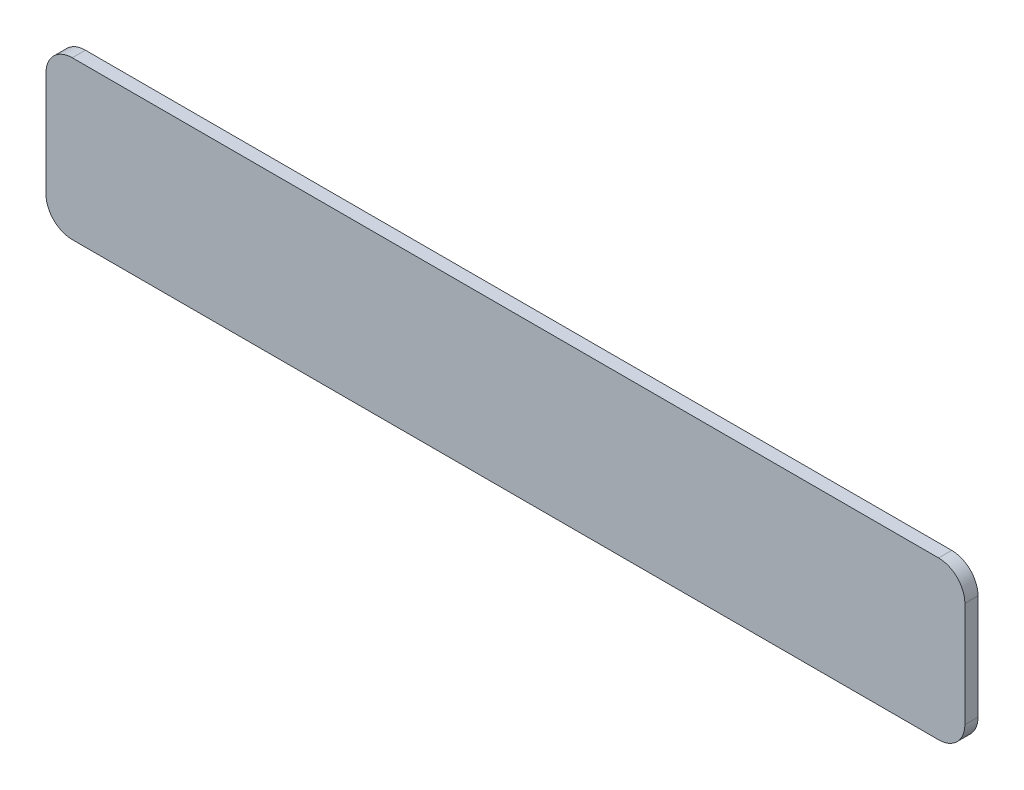
from build123d import *

# Parameters (mm, degrees)
BOSS_EXTRUDE1_DEPTH = 1


with BuildPart() as part:
    # Sketch1 → Boss-Extrude1 (new body)
    with BuildSketch(Plane.XY):
        with BuildLine():
            Line((-33, -6), (33, -6))
            ThreePointArc((33, -6), (34.414213562, -5.414213562), (35, -4))
            Line((35, -4), (35, 4))
            ThreePointArc((35, 4), (34.414213562, 5.414213562), (33, 6))
            Line((33, 6), (-33, 6))
            ThreePointArc((-33, 6), (-34.414213562, 5.414213562), (-35, 4))
            Line((-35, 4), (-35, -4))
            ThreePointArc((-35, -4), (-34.414213562, -5.414213562), (-33, -6))
        make_face()
    extrude(amount=BOSS_EXTRUDE1_DEPTH)


solid = part.part
